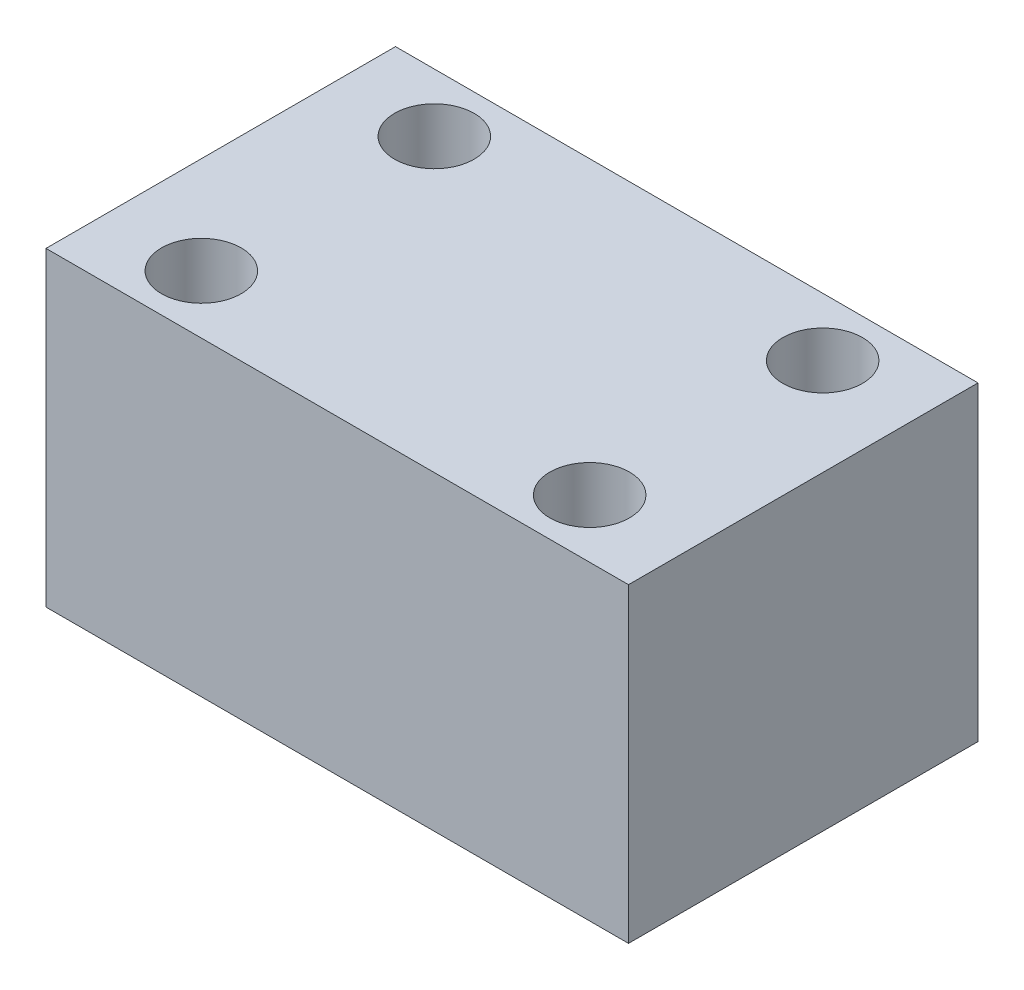
from build123d import *

# Parameters (mm, degrees)
SKETCH2_W           = 30
SKETCH2_H           = 16
BOSS_EXTRUDE1_DEPTH = 18
SKETCH3_R           = 2.05
CUT_EXTRUDE1_DEPTH  = 16


with BuildPart() as part:
    # Sketch2 → Boss-Extrude1 (new body)
    with BuildSketch(Plane.XY):
        with Locations((15, 8)):
            Rectangle(SKETCH2_W, SKETCH2_H)
    extrude(amount=-BOSS_EXTRUDE1_DEPTH)

    # Sketch3 → Cut-Extrude1 (cut)
    with BuildSketch(Plane(origin=(0, 16, 0), x_dir=(1, 0, 0), z_dir=(0, 1, 0))):
        with Locations(Location((25, 15, 0), (0, 0, 180))):
            Circle(SKETCH3_R)
        with Locations(Location((25, 3, 0), (0, 0, 180))):
            Circle(SKETCH3_R)
        with Locations(Location((5, 3, 0), (0, 0, 180))):
            Circle(SKETCH3_R)
        with Locations(Location((5, 15, 0), (0, 0, 180))):
            Circle(SKETCH3_R)
    extrude(amount=-CUT_EXTRUDE1_DEPTH, mode=Mode.SUBTRACT)


solid = part.part
